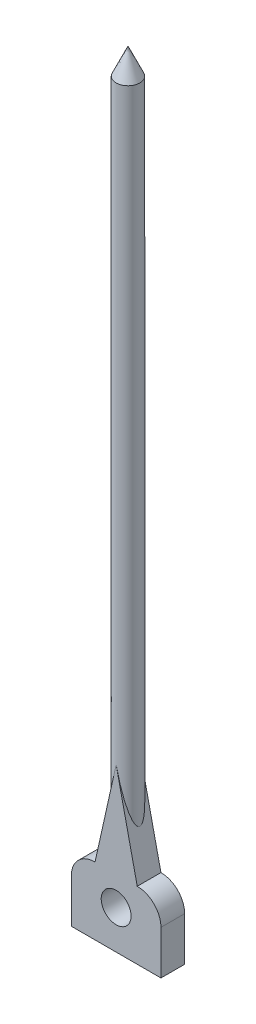
from build123d import *

# Parameters (mm, degrees)
SKETCH3_R           = 3.15
BOSS_EXTRUDE1_DEPTH = 5
SKETCH4_R           = 2.5
BOSS_EXTRUDE2_DEPTH = 150
BOSS_EXTRUDE3_DEPTH = 5


with BuildPart() as part:
    # Sketch3 → Boss-Extrude1 (new body)
    with BuildSketch(Plane.XY):
        with BuildLine():
            ThreePointArc((9.448282799, 1.1), (7.983816705, 4.635533906), (4.448282799, 6.1))
            Line((4.448282799, 6.1), (-4.448282849, 6.1))
            ThreePointArc((-4.448282849, 6.1), (-7.983816755, 4.635533906), (-9.448282849, 1.1))
            Line((-9.448282849, 1.1), (-9.448282849, -8.15))
            Line((-9.448282849, -8.15), (9.448282799, -8.15))
            Line((9.448282799, -8.15), (9.448282799, 1.1))
        make_face()
        Circle(SKETCH3_R, mode=Mode.SUBTRACT)
    extrude(amount=BOSS_EXTRUDE1_DEPTH)

    # Sketch4 → Boss-Extrude2 (add)
    with BuildSketch(Plane(origin=(0, 6.1, 0), x_dir=(1, 0, 0), z_dir=(0, 1, 0))):
        with Locations(Location((0, -2.5, 0), (0, 0, 270))):
            Circle(SKETCH4_R)
    extrude(amount=BOSS_EXTRUDE2_DEPTH)

    # Sketch6 → Cut-Revolve2 (revolve, cut)
    with BuildSketch(Plane(origin=(0, 0, 0), x_dir=(0, 0, -1), z_dir=(1, 0, 0))):
        Polygon((-2.5, 157.475466352), (-2.5, 156.1), (0, 150.602856099), (2.064701239, 157.475466352), align=None)
    revolve(axis=Axis((0, 156.1, 2.5), (0, 1, 0)), mode=Mode.SUBTRACT)

    # Sketch7 → Boss-Extrude3 (add)
    with BuildSketch(Plane(origin=(0, 0, 0), x_dir=(-1, 0, 0), z_dir=(0, 0, -1))):
        Polygon((0, 26.076539937), (4.448282849, 6.1), (-4.448282799, 6.1), align=None)
    extrude(amount=-BOSS_EXTRUDE3_DEPTH)


solid = part.part
